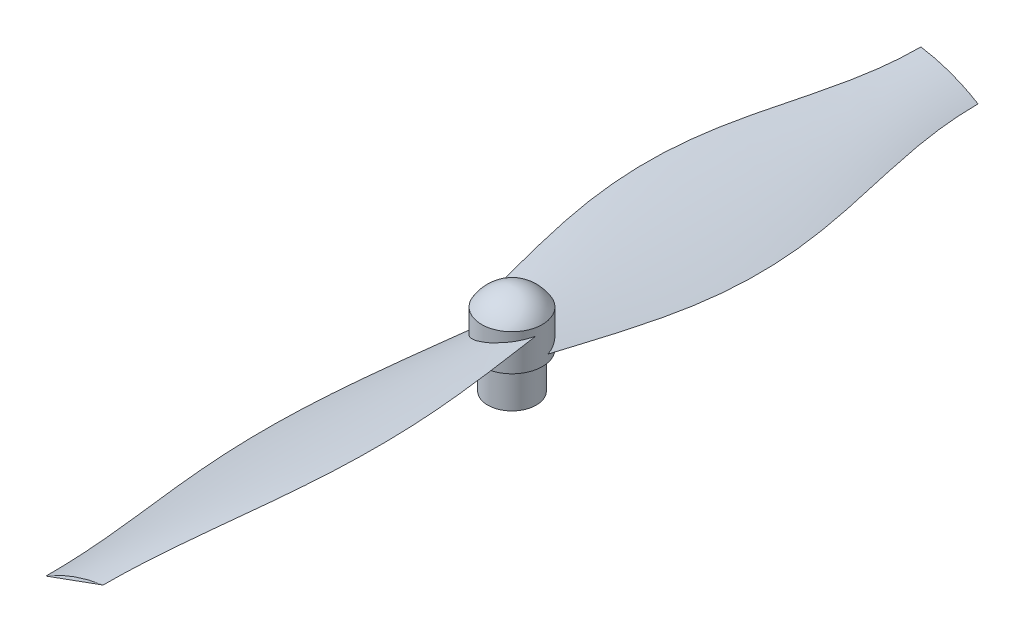
from build123d import *

# Parameters (mm, degrees)
CUT_EXTRUDE1_DEPTH = 7


with BuildPart() as part:
    # Sketch1 → Revolve1 (revolve)
    with BuildSketch(Plane.XY, mode=Mode.PRIVATE) as revolve1_sk:
        with BuildLine():
            Line((0, 0), (0, 15))
            ThreePointArc((0, 15), (2.888936029, 14.148226716), (5, 12))
            Line((5, 12), (5, 6))
            Line((5, 6), (4, 6))
            Line((4, 6), (4, 0))
            Line((4, 0), (0, 0))
        make_face()
    revolve(revolve1_sk.sketch.rotate(Axis((0, 0, 0), (0, 1, 0)), 90), axis=Axis((0, 0, 0), (0, 1, 0)))

    # Sketch2 → Cut-Extrude1 (cut)
    with BuildSketch(Plane.XZ):
        Polygon((2.886751346, 0), (1.443375673, 2.5), (-1.443375673, 2.5), (-2.886751346, 0), (-1.443375673, -2.5), (1.443375673, -2.5), align=None)
    extrude(amount=-CUT_EXTRUDE1_DEPTH, mode=Mode.SUBTRACT)


solid = part.part
